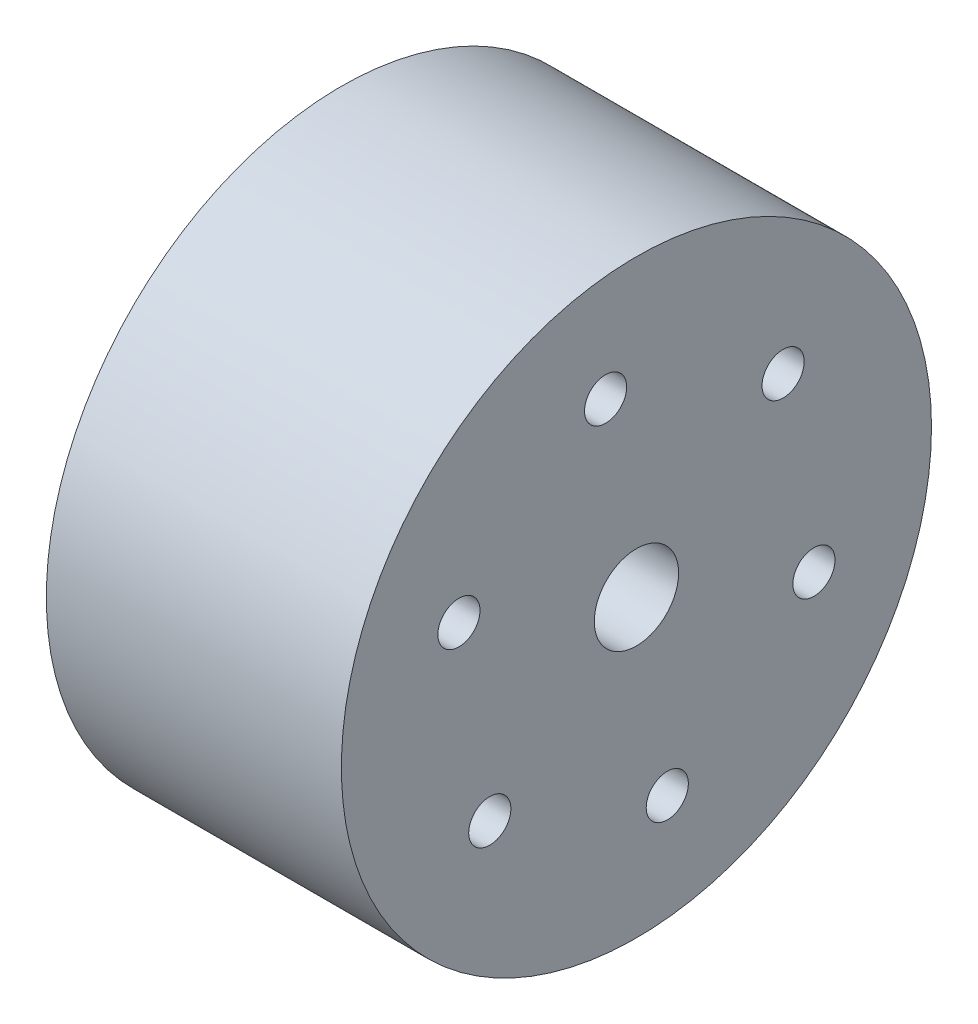
from build123d import *

# Parameters (mm, degrees)
SKETCH2_R          = 2.5
CUT_EXTRUDE1_DEPTH = 35


with BuildPart() as part:
    # Sketch1 → Revolve1 (revolve)
    with BuildSketch(Plane.XY, mode=Mode.PRIVATE) as revolve1_sk:
        Polygon((-38.716148773, 35), (-38.716148773, 16), (-33.716148773, 16), (-33.716148773, 5), (-3.716148773, 5), (-3.716148773, 35), align=None)
    revolve(revolve1_sk.sketch.rotate(Axis((0, 0, 0), (-1, 0, 0)), 90), axis=Axis((0, 0, 0), (-1, 0, 0)))

    # Sketch2 → Cut-Extrude1 (cut)
    with BuildSketch(Plane.ZY.offset(38.716148773)):
        with Locations((21.055719615, 7.931372612)):
            Circle(SKETCH2_R)
        with Locations((17.396629976, -14.269101775)):
            Circle(SKETCH2_R)
        with Locations((-3.659089638, -22.200474387)):
            Circle(SKETCH2_R)
        with Locations((-21.055719615, -7.931372612)):
            Circle(SKETCH2_R)
        with Locations((-17.396629976, 14.269101775)):
            Circle(SKETCH2_R)
        with Locations((3.659089638, 22.200474387)):
            Circle(SKETCH2_R)
    extrude(amount=-CUT_EXTRUDE1_DEPTH, mode=Mode.SUBTRACT)


solid = part.part
